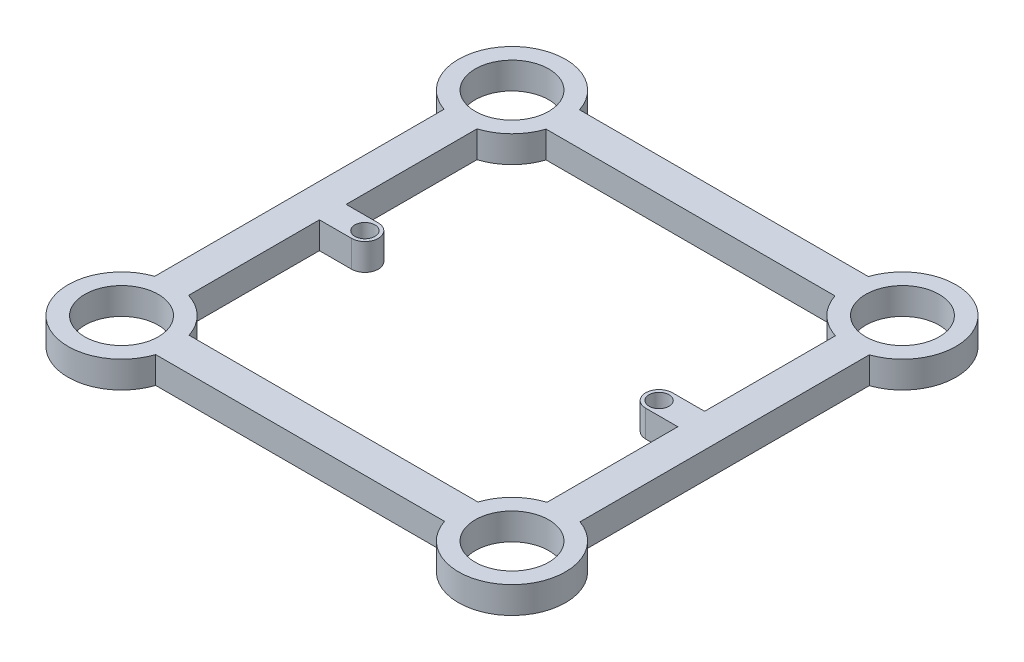
from build123d import *

# Parameters (mm, degrees)
SKETCH1_R           = 3.4925
SKETCH1_R_2         = 0.9525
BOSS_EXTRUDE1_DEPTH = 2.54


with BuildPart() as part:
    # Sketch1 → Boss-Extrude1 (new body)
    with BuildSketch(Plane(origin=(0, 0, 0), x_dir=(1, 0, 0), z_dir=(0, 1, 0))):
        with BuildLine():
            Line((-20.195257301, 13.738549126), (-20.195257301, -13.738549126))
            ThreePointArc((-20.195257301, -13.738549126), (-22.109488558, -22.158548823), (-13.716417781, -20.1295))
            Line((-13.716417781, -20.1295), (13.716417781, -20.1295))
            ThreePointArc((13.716417781, -20.1295), (22.109488558, -22.158548823), (20.195257301, -13.738549126))
            Line((20.195257301, -13.738549126), (20.195257301, 13.738549126))
            ThreePointArc((20.195257301, 13.738549126), (22.109488558, 22.158548823), (13.716417781, 20.1295))
            Line((13.716417781, 20.1295), (-13.716417781, 20.1295))
            ThreePointArc((-13.716417781, 20.1295), (-22.109488558, 22.158548823), (-20.195257301, 13.738549126))
        make_face()
        with Locations(Location((18.542, -18.542, 0), (0, 0, 270))):
            Circle(SKETCH1_R, mode=Mode.SUBTRACT)
        with Locations(Location((-18.542, -18.542, 0), (0, 0, 270))):
            Circle(SKETCH1_R, mode=Mode.SUBTRACT)
        with Locations(Location((-18.542, 18.542, 0), (0, 0, 270))):
            Circle(SKETCH1_R, mode=Mode.SUBTRACT)
        with Locations(Location((18.542, 18.542, 0), (0, 0, 270))):
            Circle(SKETCH1_R, mode=Mode.SUBTRACT)
        with Locations(Location((-13.969691774, 0, 0), (0, 0, 270))):
            Circle(SKETCH1_R_2, mode=Mode.SUBTRACT)
        with Locations(Location((13.969691774, 0, 0), (0, 0, 270))):
            Circle(SKETCH1_R_2, mode=Mode.SUBTRACT)
        with BuildLine():
            Line((-17.020257301, 13.695279546), (-17.020257301, 1.27))
            Line((-17.020257301, 1.27), (-13.969691774, 1.27))
            ThreePointArc((-13.969691774, 1.27), (-12.699691774, 0), (-13.969691774, -1.27))
            Line((-13.969691774, -1.27), (-17.020257301, -1.27))
            Line((-17.020257301, -1.27), (-17.020257301, -13.695279546))
            ThreePointArc((-17.020257301, -13.695279546), (-14.974400962, -14.925560161), (-13.716417781, -16.9545))
            Line((-13.716417781, -16.9545), (13.716417781, -16.9545))
            ThreePointArc((13.716417781, -16.9545), (14.974400962, -14.925560161), (17.020257301, -13.695279546))
            Line((17.020257301, -13.695279546), (17.020257301, -1.27))
            Line((17.020257301, -1.27), (13.969691774, -1.27))
            ThreePointArc((13.969691774, -1.27), (12.699691774, 0), (13.969691774, 1.27))
            Line((13.969691774, 1.27), (17.020257301, 1.27))
            Line((17.020257301, 1.27), (17.020257301, 13.695279546))
            ThreePointArc((17.020257301, 13.695279546), (14.974400962, 14.925560161), (13.716417781, 16.9545))
            Line((13.716417781, 16.9545), (-13.716417781, 16.9545))
            ThreePointArc((-13.716417781, 16.9545), (-14.974400962, 14.925560161), (-17.020257301, 13.695279546))
        make_face(mode=Mode.SUBTRACT)
    extrude(amount=BOSS_EXTRUDE1_DEPTH)


solid = part.part
